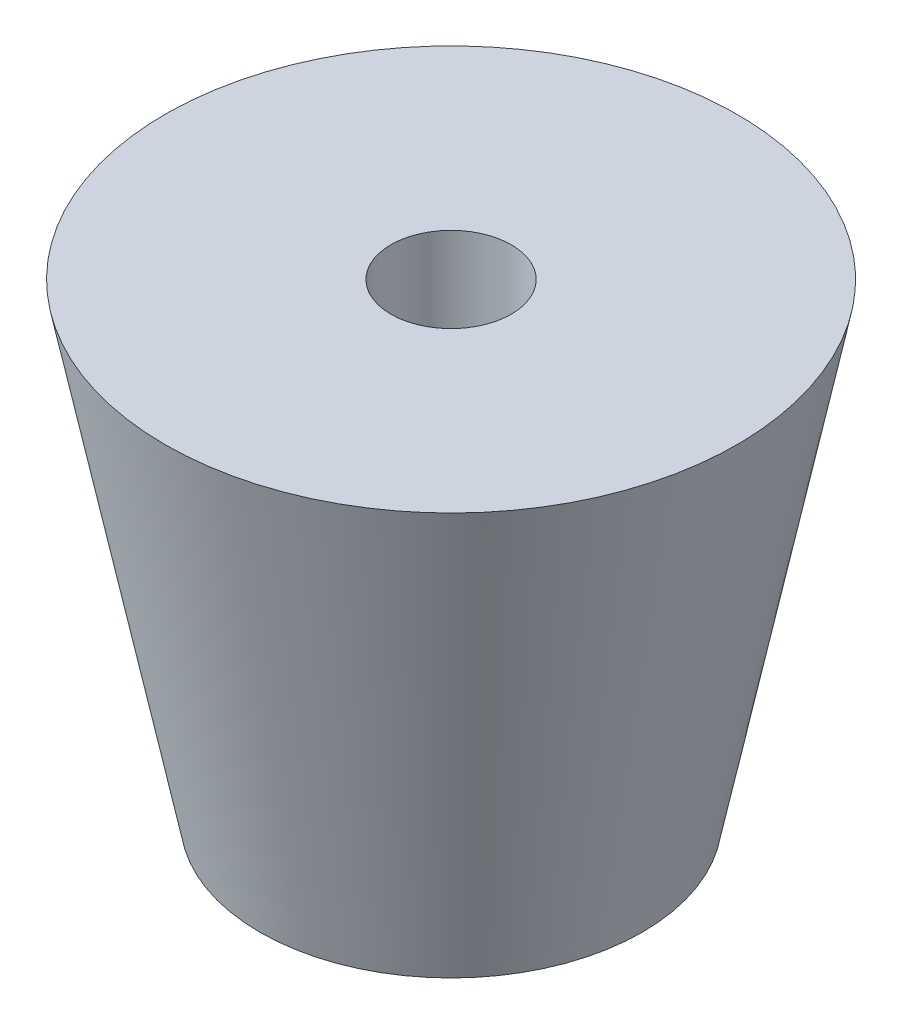
from build123d import *


with BuildPart() as part:
    # Skica1 → Rotovat1 (revolve)
    with BuildSketch(Plane.XY, mode=Mode.PRIVATE) as rotovat1_sk:
        Polygon((2, 7.367859907), (9.5, 7.367859907), (6.35, -8.232140093), (3.95, -8.232140093), (3.95, -3.432140093), (2, -3.432140093), align=None)
    revolve(rotovat1_sk.sketch.rotate(Axis((0, 11.616660217, 0), (0, -1, 0)), 90), axis=Axis((0, 11.616660217, 0), (0, -1, 0)))


solid = part.part
